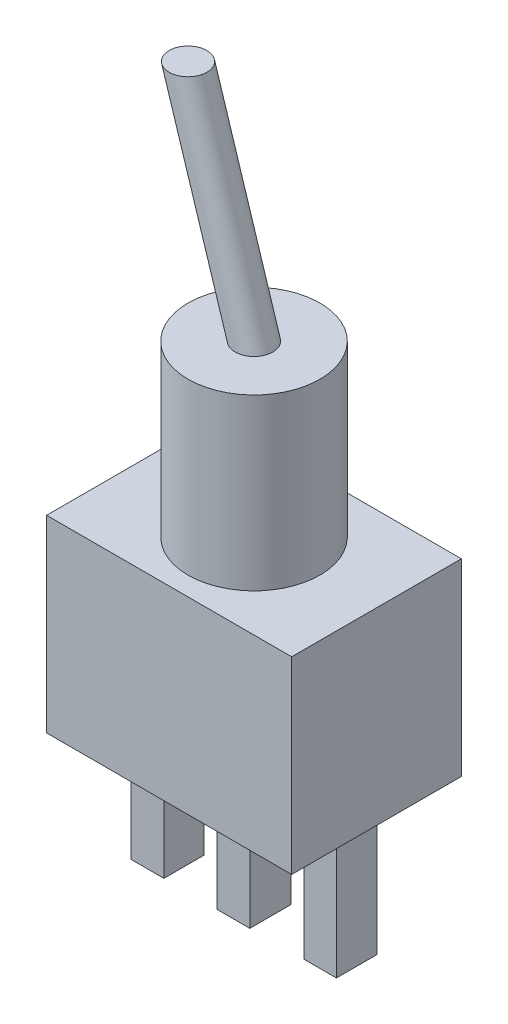
from build123d import *

# Parameters (mm, degrees)
SKETCH_1_W      = 13
SKETCH_1_H      = 9
EXTRUDE_1_DEPTH = 10
SKETCH_2_R      = 3.5
EXTRUDE_2_DEPTH = 9
SKETCH_4_R      = 1
SKETCH_5_W      = 1.73309276
SKETCH_5_H      = 2.139523058
SKETCH_5_W_2    = 1.729366682
SKETCH_5_H_2    = 2.174749504
EXTRUDE_3_DEPTH = 7


with BuildPart() as part:
    # 草图1 → 凸台-拉伸1 (new body)
    with BuildSketch(Plane(origin=(0, 0, 0), x_dir=(1, 0, 0), z_dir=(0, 1, 0))):
        Rectangle(SKETCH_1_W, SKETCH_1_H)
    extrude(amount=EXTRUDE_1_DEPTH)

    # 草图2 → 凸台-拉伸2 (add)
    with BuildSketch(Plane(origin=(0, 10, 0), x_dir=(1, 0, 0), z_dir=(0, 1, 0))):
        with Locations(Location((0, 0, 0), (0, 0, 270))):
            Circle(SKETCH_2_R)
    extrude(amount=EXTRUDE_2_DEPTH)

    # 扫描1: sweep along a path in 草图3
    with BuildLine(Plane.XY) as sweep_1_path:
        Line((0, 19), (-3.5, 30.100205658))
    # 草图4 → 扫描1 (sweep)
    with BuildSketch(Plane(origin=(0, 19, 0), x_dir=(1, 0, 0), z_dir=(0, 1, 0))):
        Circle(SKETCH_4_R)
    sweep(path=sweep_1_path.line)

    # 草图5 → 凸台-拉伸3 (add)
    with BuildSketch(Plane(origin=(0, 0, 0), x_dir=(-1, 0, 0), z_dir=(0, -1, 0))):
        with Locations((-4.576618424, 0)):
            Rectangle(SKETCH_5_W, SKETCH_5_H)
        with Locations((4.576618424, 0)):
            Rectangle(SKETCH_5_W, SKETCH_5_H)
        Rectangle(SKETCH_5_W_2, SKETCH_5_H_2)
    extrude(amount=EXTRUDE_3_DEPTH)


solid = part.part
